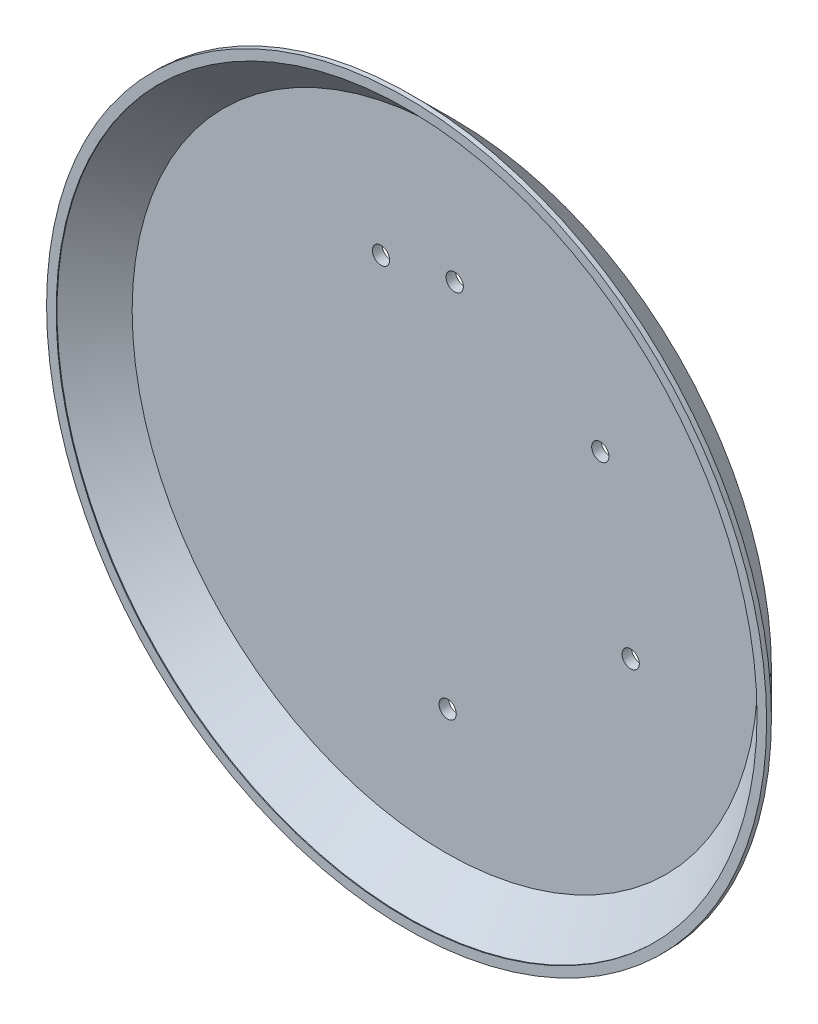
from build123d import *

# Parameters (mm, degrees)
SKETCH1_R           = 75
BOSS_EXTRUDE1_DEPTH = 10
CHAMFER1_SIZE       = 9
SHELL1_T            = -2
SKETCH2_R           = 1.8
CUT_EXTRUDE1_DEPTH  = 107.367288205


with BuildPart() as part:
    # Sketch1 → Boss-Extrude1 (new body)
    with BuildSketch(Plane.XY):
        Circle(SKETCH1_R)
    extrude(amount=BOSS_EXTRUDE1_DEPTH)

    # Chamfer1
    chamfer1_edges = [part.edges().sort_by_distance(p)[0] for p in [
        (-75, 0, 0),
    ]]
    chamfer(chamfer1_edges, length=CHAMFER1_SIZE)

    # Shell1
    shell1_openings = [part.faces().sort_by_distance(p)[0] for p in [
        (0, 0, 10),
    ]]
    offset(amount=SHELL1_T, openings=shell1_openings, kind=Kind.INTERSECTION)

    # Sketch2 → Cut-Extrude1 (cut, through all)
    with BuildSketch(Plane.XY.offset(2)):
        with Locations((2.015078633, 38.755426444)):
            Circle(SKETCH2_R)
        with Locations((-13.325453752, 35.900076006)):
            Circle(SKETCH2_R)
        with Locations((0.548769327, -39.031280101)):
            Circle(SKETCH2_R)
        with Locations((38.672351506, -10.909043386)):
            Circle(SKETCH2_R)
        with Locations((32.346402761, 23.31116451)):
            Circle(SKETCH2_R)
    extrude(amount=-CUT_EXTRUDE1_DEPTH, mode=Mode.SUBTRACT)


solid = part.part
